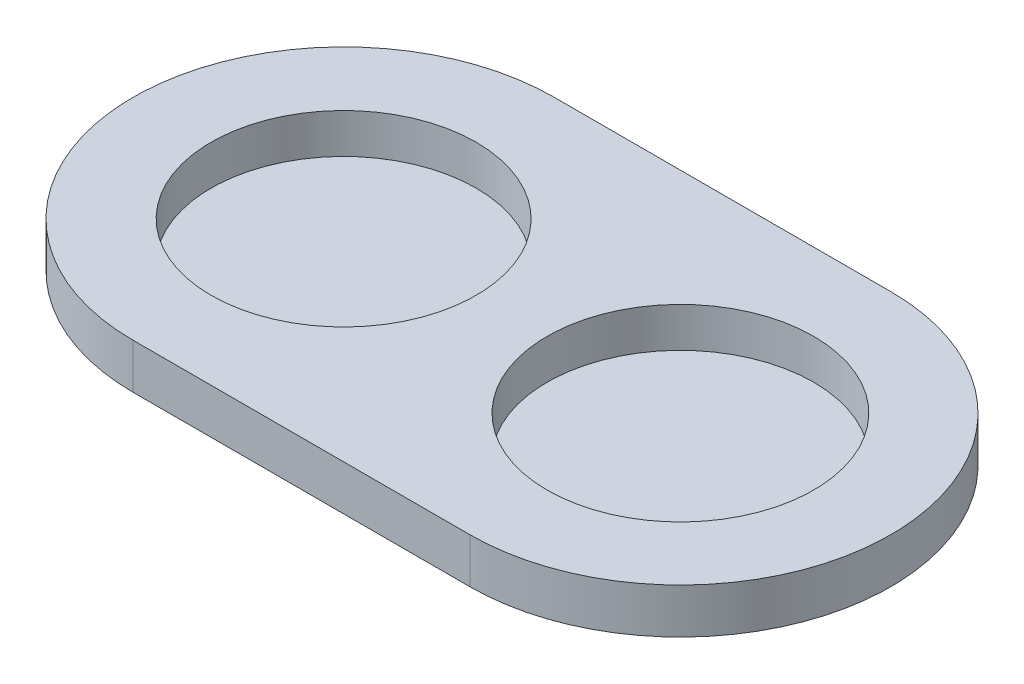
from build123d import *

# Parameters (mm, degrees)
SKETCH1_R           = 10
SKETCH1_R_2         = 10.05
BOSS_EXTRUDE1_DEPTH = 3.4
SKETCH1_2_R         = 10
SKETCH1_2_R_2       = 10.05
BOSS_EXTRUDE2_DEPTH = 0.4


with BuildPart() as part:
    # Sketch1 → Boss-Extrude1 (new body)
    with BuildSketch(Plane(origin=(0, 0, 0), x_dir=(1, 0, 0), z_dir=(0, 1, 0))):
        with BuildLine():
            Line((0, 15.875), (25.4, 15.875))
            ThreePointArc((25.4, 15.875), (41.275, 0), (25.4, -15.875))
            Line((25.4, -15.875), (0, -15.875))
            ThreePointArc((0, -15.875), (-15.875, 0), (0, 15.875))
        make_face()
        Circle(SKETCH1_R, mode=Mode.SUBTRACT)
        with Locations((25.4, 0)):
            Circle(SKETCH1_R_2, mode=Mode.SUBTRACT)
    extrude(amount=BOSS_EXTRUDE1_DEPTH)

    # Sketch1<2> → Boss-Extrude2 (add)
    with BuildSketch(Plane(origin=(0, 0, 0), x_dir=(1, 0, 0), z_dir=(0, 1, 0))):
        Circle(SKETCH1_2_R)
        with Locations((25.4, 0)):
            Circle(SKETCH1_2_R_2)
    extrude(amount=BOSS_EXTRUDE2_DEPTH)


solid = part.part
